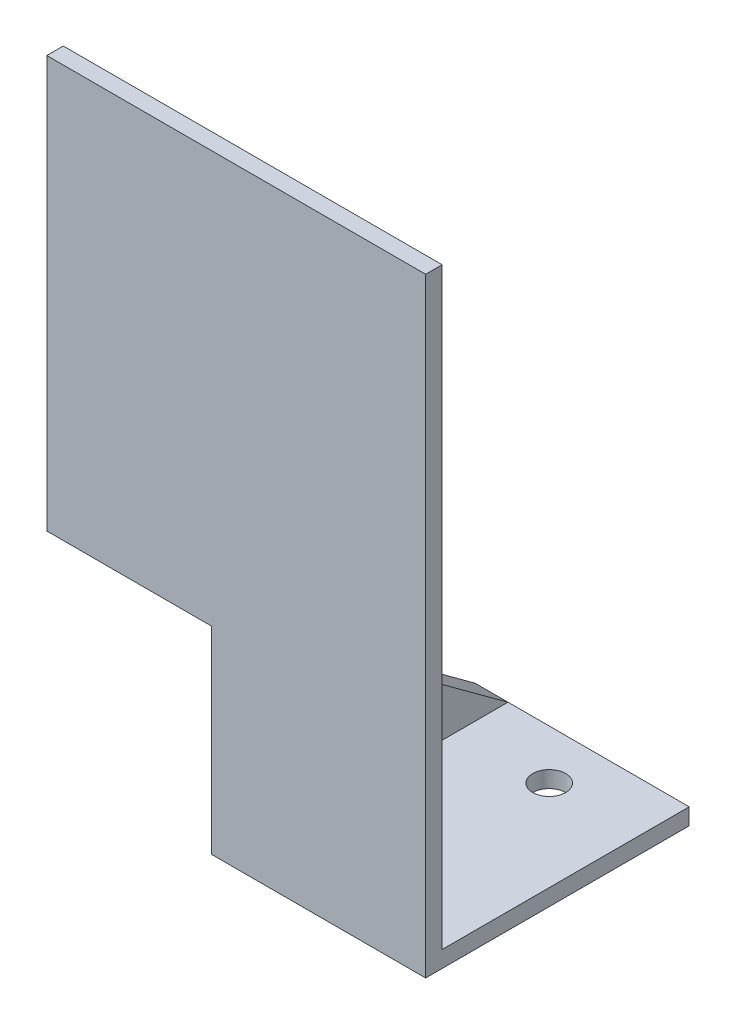
from build123d import *

# Parameters (mm, degrees)
BOSS_EXTRUDE1_DEPTH = 146.05
SKETCH2_W           = 63.5
SKETCH2_H           = 76.2
CUT_EXTRUDE1_DEPTH  = 146.05
BOSS_EXTRUDE2_DEPTH = 12.7
SKETCH4_R           = 6.35
CUT_EXTRUDE2_DEPTH  = 12.7


with BuildPart() as part:
    # Sketch1 → Boss-Extrude1 (new body)
    with BuildSketch(Plane(origin=(0, 0, 0), x_dir=(0, 0, -1), z_dir=(1, 0, 0))):
        Polygon((0, 0), (-101.6, 0), (-101.6, 6.35), (-101.6, 234.95), (-95.25, 234.95), (-95.25, 6.35), (0, 6.35), align=None)
    extrude(amount=BOSS_EXTRUDE1_DEPTH)

    # Sketch2 → Cut-Extrude1 (cut)
    with BuildSketch(Plane.XY.offset(101.6)):
        with Locations((31.75, 38.1)):
            Rectangle(SKETCH2_W, SKETCH2_H)
    extrude(amount=-CUT_EXTRUDE1_DEPTH, mode=Mode.SUBTRACT)

    # Sketch3 → Boss-Extrude2 (add)
    with BuildSketch(Plane.ZY.offset(-63.5)):
        Polygon((0, 6.35), (95.25, 76.2), (95.25, 6.35), align=None)
    extrude(amount=-BOSS_EXTRUDE2_DEPTH)

    # Sketch4 → Cut-Extrude2 (cut)
    with BuildSketch(Plane(origin=(0, 6.35, 0), x_dir=(1, 0, 0), z_dir=(0, 1, 0))):
        with Locations(Location((111.125, -19.05, 0), (0, 0, 270))):
            Circle(SKETCH4_R)
        with Locations(Location((111.125, -82.55, 0), (0, 0, 270))):
            Circle(SKETCH4_R)
    extrude(amount=-CUT_EXTRUDE2_DEPTH, mode=Mode.SUBTRACT)


solid = part.part
